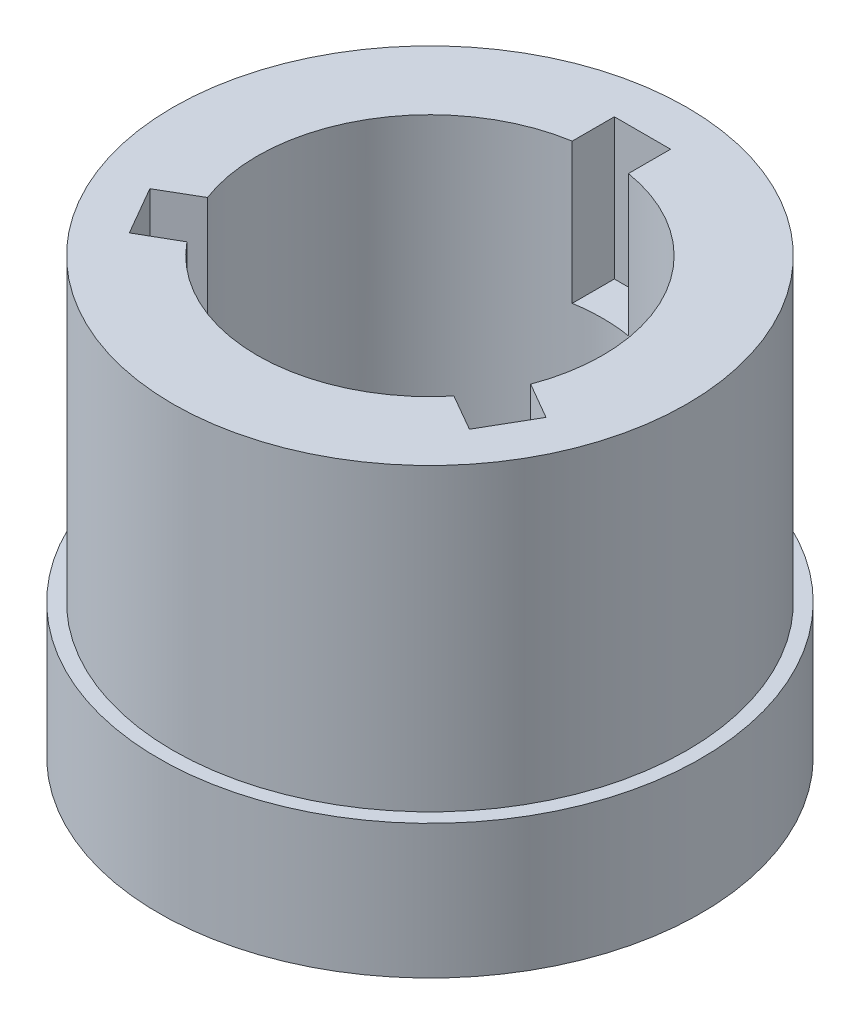
from build123d import *

# Parameters (mm, degrees)
SKETCH3_R           = 38.22429912
SKETCH3_R_2         = 30.72429912
BOSS_EXTRUDE1_DEPTH = 25
CUT_EXTRUDE1_START  = -25
CUT_EXTRUDE1_DEPTH  = 25


with BuildPart() as part:
    # Sketch1 → Revolve1 (revolve)
    with BuildSketch(Plane.XY, mode=Mode.PRIVATE) as revolve1_sk:
        with BuildLine():
            Line((-23.22429912, -43.170194275), (-30.72429912, -43.170194275))
            Line((-30.72429912, -43.170194275), (-48.22429912, -35.38123915))
            Line((-48.22429912, -35.38123915), (-48.22429912, -11.542441336))
            Line((-48.22429912, -11.542441336), (-45.72429912, -11.542441336))
            Line((-45.72429912, -11.542441336), (-45.72429912, 41.829805725))
            Line((-45.72429912, 41.829805725), (-38.22429912, 41.829805725))
            Line((-38.22429912, 41.829805725), (-38.22429912, 16.829805725))
            Line((-38.22429912, 16.829805725), (-30.72429912, 16.829805725))
            Line((-30.72429912, 16.829805725), (-30.72429912, -29.438323417))
            ThreePointArc((-30.72429912, -29.438323417), (-28.727100264, -37.261594428), (-23.22429912, -43.170194275))
        make_face()
    revolve(revolve1_sk.sketch.rotate(Axis((0, 0, 0), (0, 1, 0)), 270), axis=Axis((0, 0, 0), (0, 1, 0)))

    # Sketch3 → Boss-Extrude1 (add)
    with BuildSketch(Plane(origin=(0, 16.829805725, 0), x_dir=(1, 0, 0), z_dir=(0, 1, 0))):
        Circle(SKETCH3_R)
        with Locations(Location((0, 0, 0), (0, 0, 90))):
            Circle(SKETCH3_R_2, mode=Mode.SUBTRACT)
    extrude(amount=BOSS_EXTRUDE1_DEPTH)

    # Sketch4 → Cut-Extrude1 (cut)
    with BuildSketch(Plane(origin=(0, 41.829805725, 0), x_dir=(1, 0, 0), z_dir=(0, 1, 0)).offset(CUT_EXTRUDE1_START)):
        with BuildLine():
            Line((-5, 37.814725075), (-5, 30.314725075))
            ThreePointArc((-5, 30.314725075), (0, 30.72429912), (5, 30.314725075))
            Line((5, 30.314725075), (5, 37.814725075))
            Line((5, 37.814725075), (-5, 37.814725075))
        make_face()
        with BuildLine():
            Line((30.254977775, -23.229071276), (23.753322024, -19.487489557))
            ThreePointArc((23.753322024, -19.487489557), (26.608023551, -15.36214956), (28.753322024, -10.827235519))
            Line((28.753322024, -10.827235519), (35.244454719, -14.587043706))
            Line((35.244454719, -14.587043706), (30.254977775, -23.229071276))
        make_face()
        with BuildLine():
            Line((-35.244454719, -14.587043706), (-28.753322024, -10.827235519))
            ThreePointArc((-28.753322024, -10.827235519), (-26.608023551, -15.36214956), (-23.753322024, -19.487489557))
            Line((-23.753322024, -19.487489557), (-30.254977775, -23.229071276))
            Line((-30.254977775, -23.229071276), (-35.244454719, -14.587043706))
        make_face()
    extrude(amount=CUT_EXTRUDE1_DEPTH, mode=Mode.SUBTRACT)


solid = part.part
